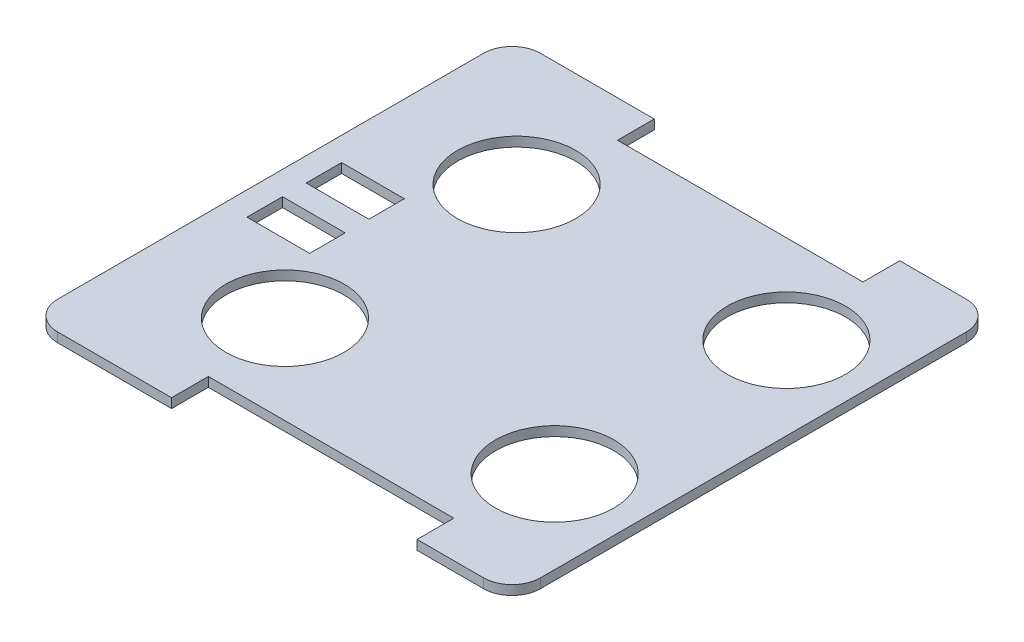
from build123d import *

# Parameters (mm, degrees)
SALIENTE_EXTRUIR1_DEPTH = 4
CORTAR_EXTRUIR1_REACH   = 536.422
CROQUIS2_R              = 50
CROQUIS2_W              = 53
CROQUIS2_H              = 30


with BuildPart() as part:
    # Croquis1 → Saliente-Extruir1 (new, symmetric)
    with BuildSketch(Plane(origin=(0, 54.707138557, 0), x_dir=(1, 0, 0), z_dir=(0, 1, 0))):
        with BuildLine():
            Line((-135.857036721, -92.1), (71.652963279, -92.1))
            Line((71.652963279, -92.1), (71.652963279, -61.00446543))
            Line((71.652963279, -61.00446543), (127.897963279, -61.00446543))
            ThreePointArc((127.897963279, -61.00446543), (144.865368491, -68.032594788), (151.893497848, -85))
            Line((151.893497848, -85), (151.893497848, -445))
            ThreePointArc((151.893497848, -445), (144.865368491, -461.967405212), (127.897963279, -468.99553457))
            Line((127.897963279, -468.99553457), (71.652963279, -468.99553457))
            Line((71.652963279, -468.99553457), (71.652963279, -437.9))
            Line((71.652963279, -437.9), (-135.857036721, -437.9))
            Line((-135.857036721, -437.9), (-135.857036721, -468.99553457))
            Line((-135.857036721, -468.99553457), (-232.102036721, -468.99553457))
            ThreePointArc((-232.102036721, -468.99553457), (-249.069441934, -461.967405212), (-256.097571291, -445))
            Line((-256.097571291, -445), (-256.097571291, -85))
            ThreePointArc((-256.097571291, -85), (-249.069441934, -68.032594788), (-232.102036721, -61.00446543))
            Line((-232.102036721, -61.00446543), (-135.857036721, -61.00446543))
            Line((-135.857036721, -61.00446543), (-135.857036721, -92.1))
        make_face()
    extrude(amount=SALIENTE_EXTRUIR1_DEPTH, both=True)

    # Croquis2 → Cortar-Extruir1 (cut, up to next)
    with BuildSketch(Plane(origin=(0, 58.707138557, 0), x_dir=(1, 0, 0), z_dir=(0, 1, 0)), mode=Mode.PRIVATE) as cortar_extruir1_sk1:
        with Locations(Location((-146.097571291, -167.1, 0), (0, 0, 270))):
            Circle(CROQUIS2_R)
    cortar_extruir1_tool1 = extrude(cortar_extruir1_sk1.sketch, amount=-CORTAR_EXTRUIR1_REACH, mode=Mode.PRIVATE) & part.part
    # Croquis2 → Cortar-Extruir1 (cut, up to next)
    with BuildSketch(Plane(origin=(0, 58.707138557, 0), x_dir=(1, 0, 0), z_dir=(0, 1, 0)), mode=Mode.PRIVATE) as cortar_extruir1_sk2:
        with Locations(Location((81.893497848, -167.1, 0), (0, 0, 270))):
            Circle(CROQUIS2_R)
    cortar_extruir1_tool2 = extrude(cortar_extruir1_sk2.sketch, amount=-CORTAR_EXTRUIR1_REACH, mode=Mode.PRIVATE) & part.part
    # Croquis2 → Cortar-Extruir1 (cut, up to next)
    with BuildSketch(Plane(origin=(0, 58.707138557, 0), x_dir=(1, 0, 0), z_dir=(0, 1, 0)), mode=Mode.PRIVATE) as cortar_extruir1_sk3:
        with Locations(Location((81.893497848, -362.9, 0), (0, 0, 270))):
            Circle(CROQUIS2_R)
    cortar_extruir1_tool3 = extrude(cortar_extruir1_sk3.sketch, amount=-CORTAR_EXTRUIR1_REACH, mode=Mode.PRIVATE) & part.part
    # Croquis2 → Cortar-Extruir1 (cut, up to next)
    with BuildSketch(Plane(origin=(0, 58.707138557, 0), x_dir=(1, 0, 0), z_dir=(0, 1, 0)), mode=Mode.PRIVATE) as cortar_extruir1_sk4:
        with Locations(Location((-146.097571291, -362.9, 0), (0, 0, 270))):
            Circle(CROQUIS2_R)
    cortar_extruir1_tool4 = extrude(cortar_extruir1_sk4.sketch, amount=-CORTAR_EXTRUIR1_REACH, mode=Mode.PRIVATE) & part.part
    # Croquis2 → Cortar-Extruir1 (cut, up to next)
    with BuildSketch(Plane(origin=(0, 58.707138557, 0), x_dir=(1, 0, 0), z_dir=(0, 1, 0)), mode=Mode.PRIVATE) as cortar_extruir1_sk5:
        with Locations((-209.597571291, -290)):
            Rectangle(CROQUIS2_W, CROQUIS2_H)
    cortar_extruir1_tool5 = extrude(cortar_extruir1_sk5.sketch, amount=-CORTAR_EXTRUIR1_REACH, mode=Mode.PRIVATE) & part.part
    # Croquis2 → Cortar-Extruir1 (cut, up to next)
    with BuildSketch(Plane(origin=(0, 58.707138557, 0), x_dir=(1, 0, 0), z_dir=(0, 1, 0)), mode=Mode.PRIVATE) as cortar_extruir1_sk6:
        with Locations((-209.597571291, -240)):
            Rectangle(CROQUIS2_W, CROQUIS2_H)
    cortar_extruir1_tool6 = extrude(cortar_extruir1_sk6.sketch, amount=-CORTAR_EXTRUIR1_REACH, mode=Mode.PRIVATE) & part.part
    add(cortar_extruir1_tool1.solids().sort_by_distance((-146.097571, 58.707139, 167.1))[0], mode=Mode.SUBTRACT)
    add(cortar_extruir1_tool2.solids().sort_by_distance((81.893498, 58.707139, 167.1))[0], mode=Mode.SUBTRACT)
    add(cortar_extruir1_tool3.solids().sort_by_distance((81.893498, 58.707139, 362.9))[0], mode=Mode.SUBTRACT)
    add(cortar_extruir1_tool4.solids().sort_by_distance((-146.097571, 58.707139, 362.9))[0], mode=Mode.SUBTRACT)
    add(cortar_extruir1_tool5.solids().sort_by_distance((-209.597571, 58.707139, 290))[0], mode=Mode.SUBTRACT)
    add(cortar_extruir1_tool6.solids().sort_by_distance((-209.597571, 58.707139, 240))[0], mode=Mode.SUBTRACT)


solid = part.part
